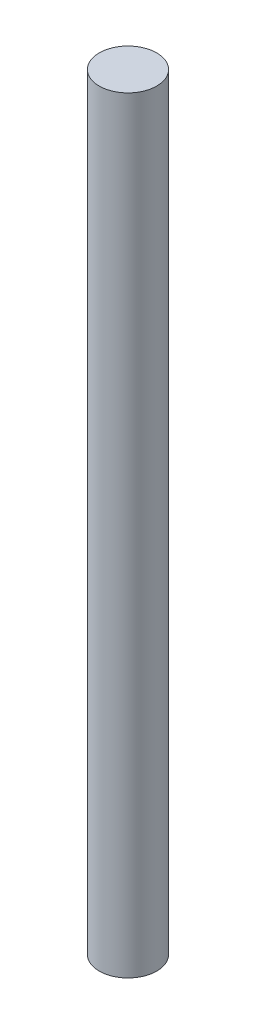
from build123d import *

# Parameters (mm, degrees)
SKETCH1_R           = 1.905
BOSS_EXTRUDE1_DEPTH = 50.8


with BuildPart() as part:
    # Sketch1 → Boss-Extrude1 (new body)
    with BuildSketch(Plane(origin=(0, 0, 0), x_dir=(1, 0, 0), z_dir=(0, 1, 0))):
        with Locations(Location((0, 0, 0), (0, 0, 270))):
            Circle(SKETCH1_R)
    extrude(amount=BOSS_EXTRUDE1_DEPTH)


solid = part.part
